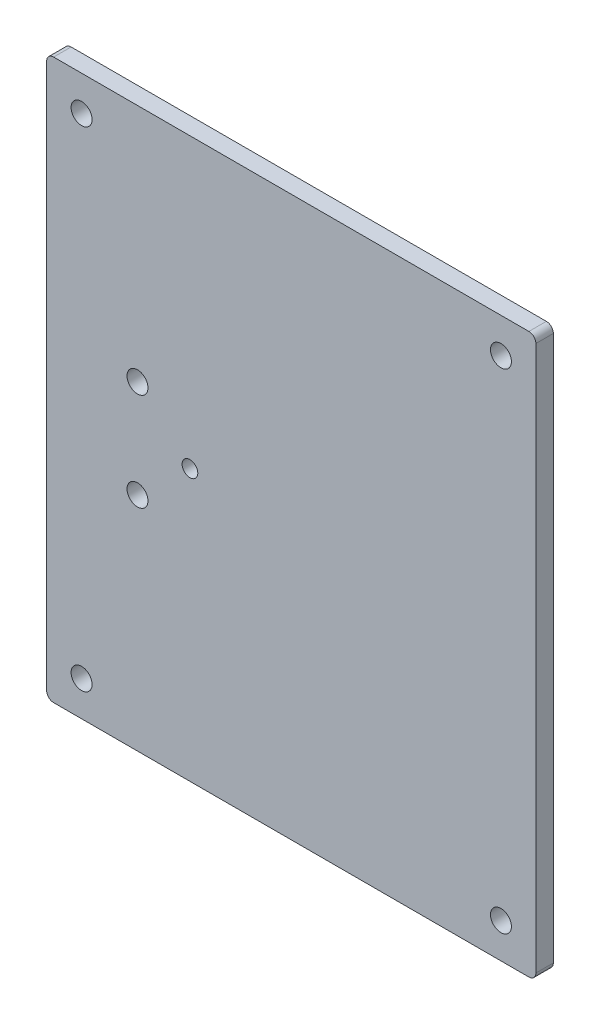
from build123d import *

# Parameters (mm, degrees)
MODEL_W             = 140
MODEL_H             = 160
MODEL_R             = 3
MODEL_R_2           = 2.25
BOSS_EXTRUDE1_DEPTH = 5
FILLET1_R           = 2


with BuildPart() as part:
    # Model → Boss-Extrude1 (new body)
    with BuildSketch(Plane.XY):
        with Locations((70, 80)):
            Rectangle(MODEL_W, MODEL_H)
        with Locations((26, 91.5)):
            Circle(MODEL_R, mode=Mode.SUBTRACT)
        with Locations((10, 150)):
            Circle(MODEL_R, mode=Mode.SUBTRACT)
        with Locations((130, 10)):
            Circle(MODEL_R, mode=Mode.SUBTRACT)
        with Locations((10, 10)):
            Circle(MODEL_R, mode=Mode.SUBTRACT)
        with Locations((130, 150)):
            Circle(MODEL_R, mode=Mode.SUBTRACT)
        with Locations((26, 63.5)):
            Circle(MODEL_R, mode=Mode.SUBTRACT)
        with Locations((41, 77.5)):
            Circle(MODEL_R_2, mode=Mode.SUBTRACT)
    extrude(amount=BOSS_EXTRUDE1_DEPTH)

    # Fillet1
    fillet1_edges = [part.edges().sort_by_distance(p)[0] for p in [
        (0, 0, 2.5),
        (0, 160, 2.5),
        (140, 160, 2.5),
        (140, 0, 2.5),
    ]]
    fillet(fillet1_edges, radius=FILLET1_R)


solid = part.part
